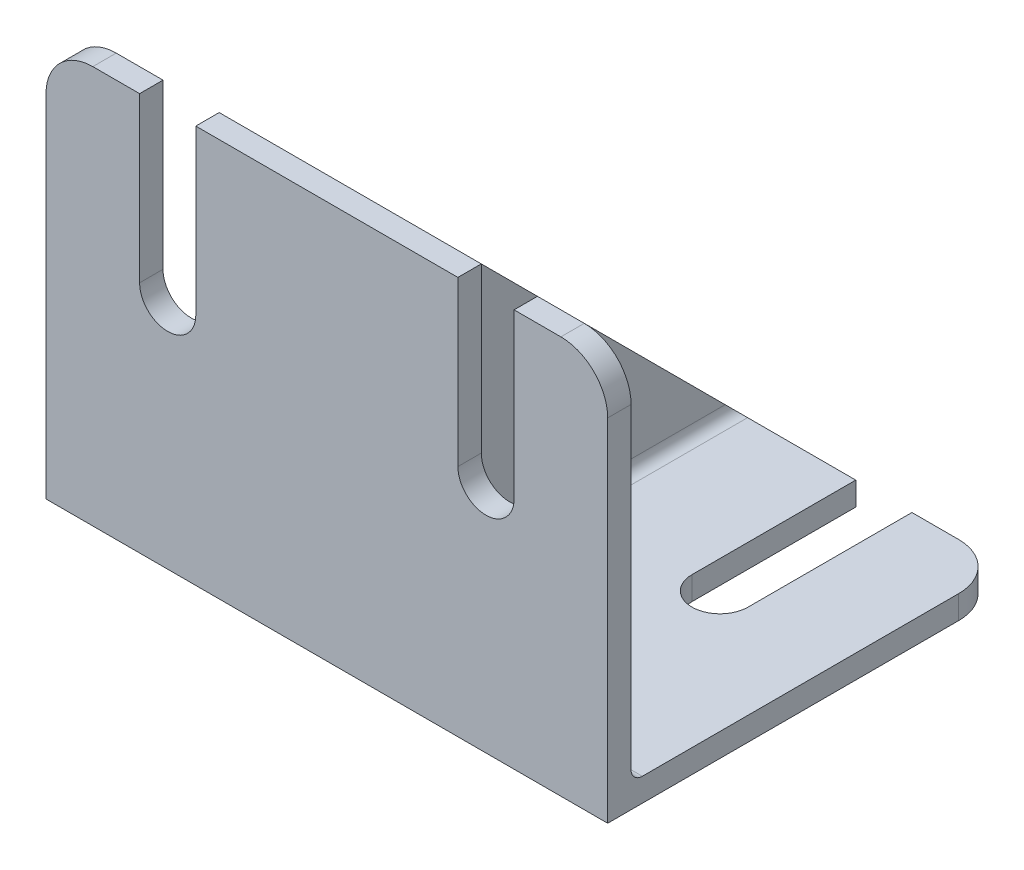
from build123d import *

# Parameters (mm, degrees)
EXTRUDE_THIN1_DEPTH = 76.2
FILLET1_R           = 6.35
BOSS_EXTRUDE1_REACH = 88.253
SKETCH2_W           = 3.175
SKETCH2_H           = 71.842048968
CUT_EXTRUDE1_DEPTH  = 105.726882891
CUT_EXTRUDE2_DEPTH  = 105.726882891
FILLET2_R           = 1.524


with BuildPart() as part:
    # Sketch1 → Extrude-Thin1 (new body)
    with BuildSketch(Plane(origin=(0, 0, 0), x_dir=(0, 0, -1), z_dir=(1, 0, 0))):
        Polygon((50.8, 0), (0, 0), (0, 50.8), (-3.175, 50.8), (-3.175, -3.175), (50.8, -3.175), align=None)
    extrude(amount=EXTRUDE_THIN1_DEPTH)

    # Fillet1
    fillet1_edges = [part.edges().sort_by_distance(p)[0] for p in [
        (76.2, -1.5875, -50.8),
        (0, -1.5875, -50.8),
        (0, 50.8, 1.5875),
        (76.2, 50.8, 1.5875),
    ]]
    fillet(fillet1_edges, radius=FILLET1_R)

    # Sketch2 → Boss-Extrude1 (add, up to next)
    with BuildSketch(Plane(origin=(0, 25.4, -25.4), x_dir=(1, 0, 0), z_dir=(0, -0.7071067811865477, 0.7071067811865475)), mode=Mode.PRIVATE) as boss_extrude1_sk1:
        with Locations((38.1, 0)):
            Rectangle(SKETCH2_W, SKETCH2_H)
    boss_extrude1_tool1 = extrude(boss_extrude1_sk1.sketch, amount=BOSS_EXTRUDE1_REACH, mode=Mode.PRIVATE) - part.part
    add(boss_extrude1_tool1.solids().sort_by_distance((38.1, 25.4, -25.4))[0])

    # Sketch3 → Cut-Extrude1 (cut, through all)
    with BuildSketch(Plane.XY):
        with BuildLine():
            Line((12.7, 28.575), (12.7, 73.025))
            ThreePointArc((12.7, 73.025), (16.51, 76.835), (20.32, 73.025))
            Line((20.32, 73.025), (20.32, 28.575))
            ThreePointArc((20.32, 28.575), (16.51, 24.765), (12.7, 28.575))
        make_face()
        with BuildLine():
            Line((63.5, 28.575), (63.5, 73.025))
            ThreePointArc((63.5, 73.025), (59.69, 76.835), (55.88, 73.025))
            Line((55.88, 73.025), (55.88, 28.575))
            ThreePointArc((55.88, 28.575), (59.69, 24.765), (63.5, 28.575))
        make_face()
    extrude(amount=CUT_EXTRUDE1_DEPTH, mode=Mode.SUBTRACT)

    # Sketch4 → Cut-Extrude2 (cut, through all)
    with BuildSketch(Plane(origin=(0, 0, 0), x_dir=(1, 0, 0), z_dir=(0, 1, 0))):
        with BuildLine():
            Line((20.32, 73.025), (20.32, 28.575))
            ThreePointArc((20.32, 28.575), (16.51, 24.765), (12.7, 28.575))
            Line((12.7, 28.575), (12.7, 73.025))
            ThreePointArc((12.7, 73.025), (16.51, 76.835), (20.32, 73.025))
        make_face()
        with BuildLine():
            Line((55.88, 73.025), (55.88, 28.575))
            ThreePointArc((55.88, 28.575), (59.69, 24.765), (63.5, 28.575))
            Line((63.5, 28.575), (63.5, 73.025))
            ThreePointArc((63.5, 73.025), (59.69, 76.835), (55.88, 73.025))
        make_face()
    extrude(amount=-CUT_EXTRUDE2_DEPTH, mode=Mode.SUBTRACT)

    # Fillet2
    fillet2_edges = [part.edges().sort_by_distance(p)[0] for p in [
        (18.25625, 0, 0),
        (39.6875, 25.4, 0),
        (36.5125, 25.4, 0),
        (39.6875, 0, -25.4),
        (36.5125, 0, -25.4),
        (57.94375, 0, 0),
    ]]
    fillet(fillet2_edges, radius=FILLET2_R)


solid = part.part
